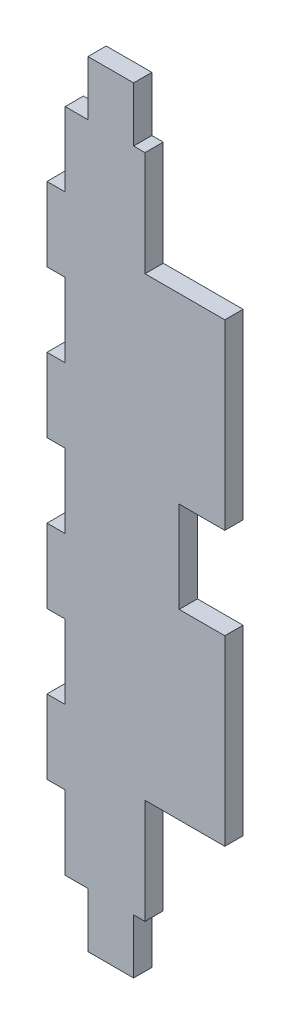
from build123d import *

# Parameters (mm, degrees)
BOSS_EXTRUDE1_DEPTH = 5.08
SKETCH2_W           = 25.4
SKETCH2_H           = 25.4
CUT_EXTRUDE1_DEPTH  = 206.587072794


with BuildPart() as part:
    # Sketch1 → Boss-Extrude1 (new body)
    with BuildSketch(Plane.XY):
        Polygon((0, 0), (0, -20.602222222), (-5.08, -20.602222222), (-5.08, -41.204444444), (0, -41.204444444), (0, -61.806666667), (-5.08, -61.806666667), (-5.08, -82.408888889), (0, -82.408888889), (0, -103.011111111), (-5.08, -103.011111111), (-5.08, -123.613333333), (0, -123.613333333), (0, -144.215555556), (-5.08, -144.215555556), (-5.08, -164.817777778), (0, -164.817777778), (0, -185.42), (6.35, -185.42), (6.35, -200.66), (19.05, -200.66), (19.05, -185.42), (22.225, -185.42), (22.225, -156.21), (44.45, -156.21), (44.45, -29.21), (22.225, -29.21), (22.225, 0), (19.05, 0), (19.05, 15.24), (6.35, 15.24), (6.35, 0), align=None)
    extrude(amount=BOSS_EXTRUDE1_DEPTH)

    # Sketch2 → Cut-Extrude1 (cut, through all)
    with BuildSketch(Plane.XY.offset(5.08)):
        with Locations((44.45, -92.71)):
            Rectangle(SKETCH2_W, SKETCH2_H)
    extrude(amount=-CUT_EXTRUDE1_DEPTH, mode=Mode.SUBTRACT)


solid = part.part
